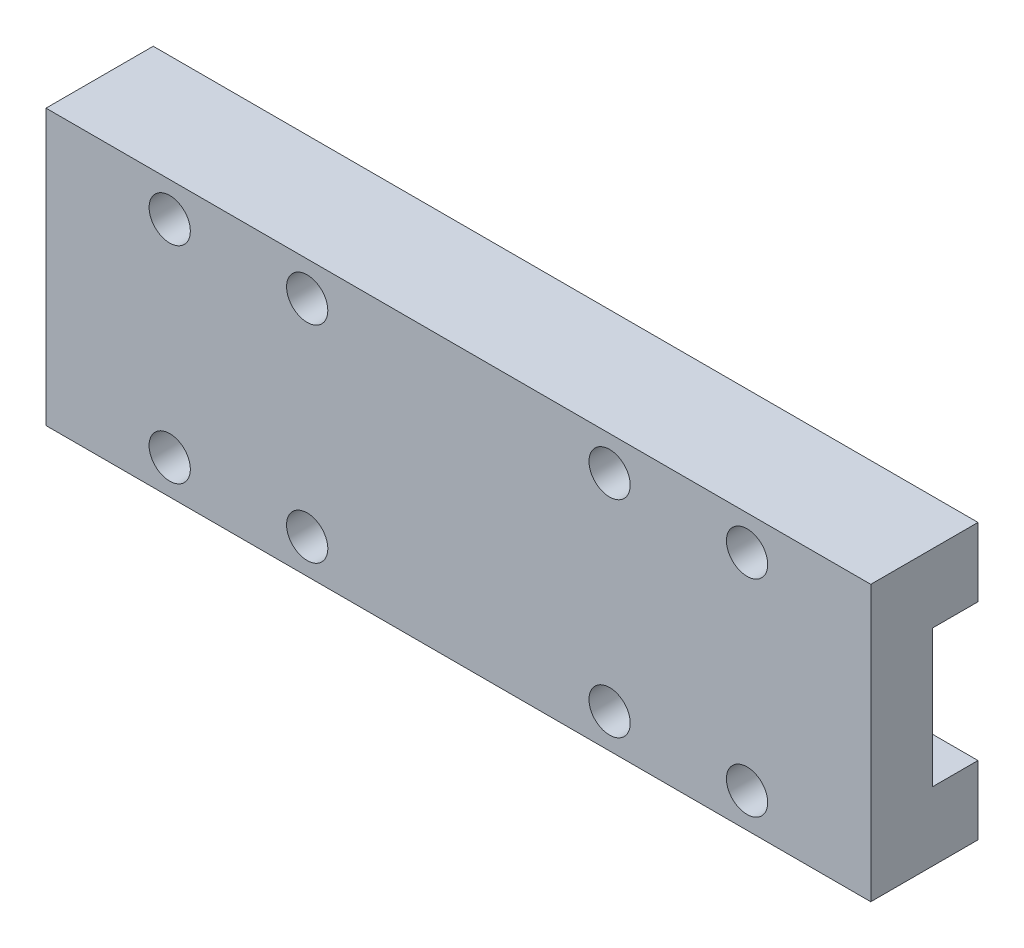
from build123d import *

# Parameters (mm, degrees)
ESQUISSE1_W             = 60
ESQUISSE1_H             = 20
BOSS_EXTRU_1_DEPTH      = 7.8
ESQUISSE2_W             = 60
ESQUISSE2_H             = 10
ENL_V_MAT_EXTRU_1_DEPTH = 3.3
ESQUISSE4_R             = 1.5
ENL_V_MAT_EXTRU_2_DEPTH = 3


with BuildPart() as part:
    # Esquisse1 → Boss.-Extru.1 (new body)
    with BuildSketch(Plane.XY):
        with Locations((-30, 10)):
            Rectangle(ESQUISSE1_W, ESQUISSE1_H)
    extrude(amount=BOSS_EXTRU_1_DEPTH)

    # Esquisse2 → Enlèv. mat.-Extru.1 (cut)
    with BuildSketch(Plane(origin=(0, 0, 0), x_dir=(-1, 0, 0), z_dir=(0, 0, -1))):
        with Locations((30, 10)):
            Rectangle(ESQUISSE2_W, ESQUISSE2_H)
    extrude(amount=-ENL_V_MAT_EXTRU_1_DEPTH, mode=Mode.SUBTRACT)

    # Esquisse4 → Enlèv. mat.-Extru.2 (cut)
    with BuildSketch(Plane.XY.offset(7.8)):
        with Locations((-51, 17.5)):
            Circle(ESQUISSE4_R)
        with Locations((-41, 17.5)):
            Circle(ESQUISSE4_R)
        with Locations((-19, 17.5)):
            Circle(ESQUISSE4_R)
        with Locations((-9, 17.5)):
            Circle(ESQUISSE4_R)
        with Locations(Location((-9, 2.5, 0), (0, 0, 180))):
            Circle(ESQUISSE4_R)
        with Locations(Location((-19, 2.5, 0), (0, 0, 180))):
            Circle(ESQUISSE4_R)
        with Locations(Location((-41, 2.5, 0), (0, 0, 180))):
            Circle(ESQUISSE4_R)
        with Locations(Location((-51, 2.5, 0), (0, 0, 180))):
            Circle(ESQUISSE4_R)
    extrude(amount=-ENL_V_MAT_EXTRU_2_DEPTH, mode=Mode.SUBTRACT)


solid = part.part
